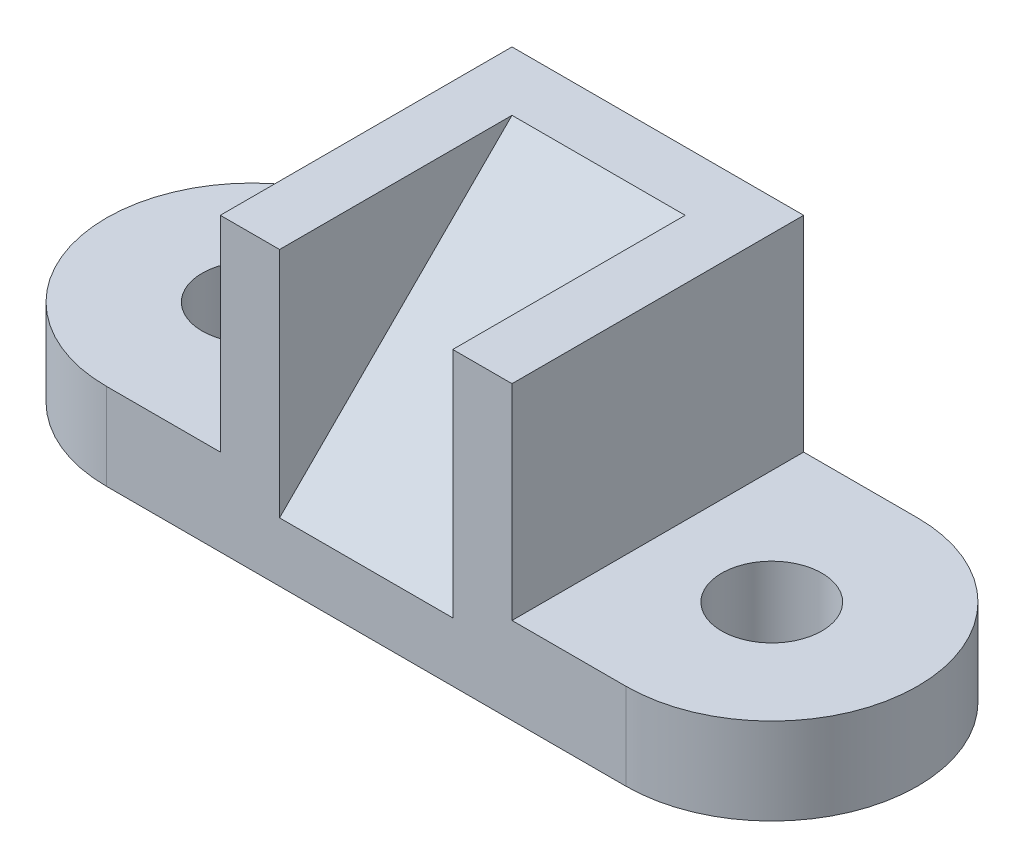
from build123d import *

# Parameters (mm, degrees)
SKETCH1_R               = 11
BOSS_EXTRUDE1_DEPTH     = 19
SKETCH2_W               = 64
SKETCH2_H               = 64
BOSS_EXTRUDE2_DEPTH     = 45
CUT_EXTRUDE3_DEPTH      = 127.936992244
CUT_EXTRUDE3_DEPTH_BACK = 51
SKETCH7_W               = 38
SKETCH7_H               = 51
BOSS_EXTRUDE3_DEPTH     = 51


with BuildPart() as part:
    # Sketch1 → Boss-Extrude1 (new body)
    with BuildSketch(Plane(origin=(0, 0, 0), x_dir=(1, 0, 0), z_dir=(0, 1, 0))):
        with BuildLine():
            Line((-57, 32), (57, 32))
            ThreePointArc((57, 32), (89, 0), (57, -32))
            Line((57, -32), (-57, -32))
            ThreePointArc((-57, -32), (-89, 0), (-57, 32))
        make_face()
        with Locations(Location((-57, 0, 0), (0, 0, 270))):
            Circle(SKETCH1_R, mode=Mode.SUBTRACT)
        with Locations(Location((57, 0, 0), (0, 0, 270))):
            Circle(SKETCH1_R, mode=Mode.SUBTRACT)
    extrude(amount=BOSS_EXTRUDE1_DEPTH)

    # Sketch2 → Boss-Extrude2 (add)
    with BuildSketch(Plane(origin=(0, 19, 0), x_dir=(1, 0, 0), z_dir=(0, 1, 0))):
        Rectangle(SKETCH2_W, SKETCH2_H)
    extrude(amount=BOSS_EXTRUDE2_DEPTH)

    # Sketch7 → Cut-Extrude3 (cut, two sides: drawn at the far end of the back side and taken through both)
    with BuildSketch(Plane.XY.offset(32).offset(-CUT_EXTRUDE3_DEPTH_BACK)):
        with Locations((0, 38.5)):
            Rectangle(SKETCH7_W, SKETCH7_H)
    extrude(amount=CUT_EXTRUDE3_DEPTH + CUT_EXTRUDE3_DEPTH_BACK, mode=Mode.SUBTRACT)

    # Sketch11 → Boss-Extrude3 (add)
    with BuildSketch(Plane(origin=(-19, 0, 0), x_dir=(0, 0, -1), z_dir=(1, 0, 0))):
        Polygon((-32, 13), (19, 64), (19, 13), align=None)
    extrude(amount=BOSS_EXTRUDE3_DEPTH)


solid = part.part
